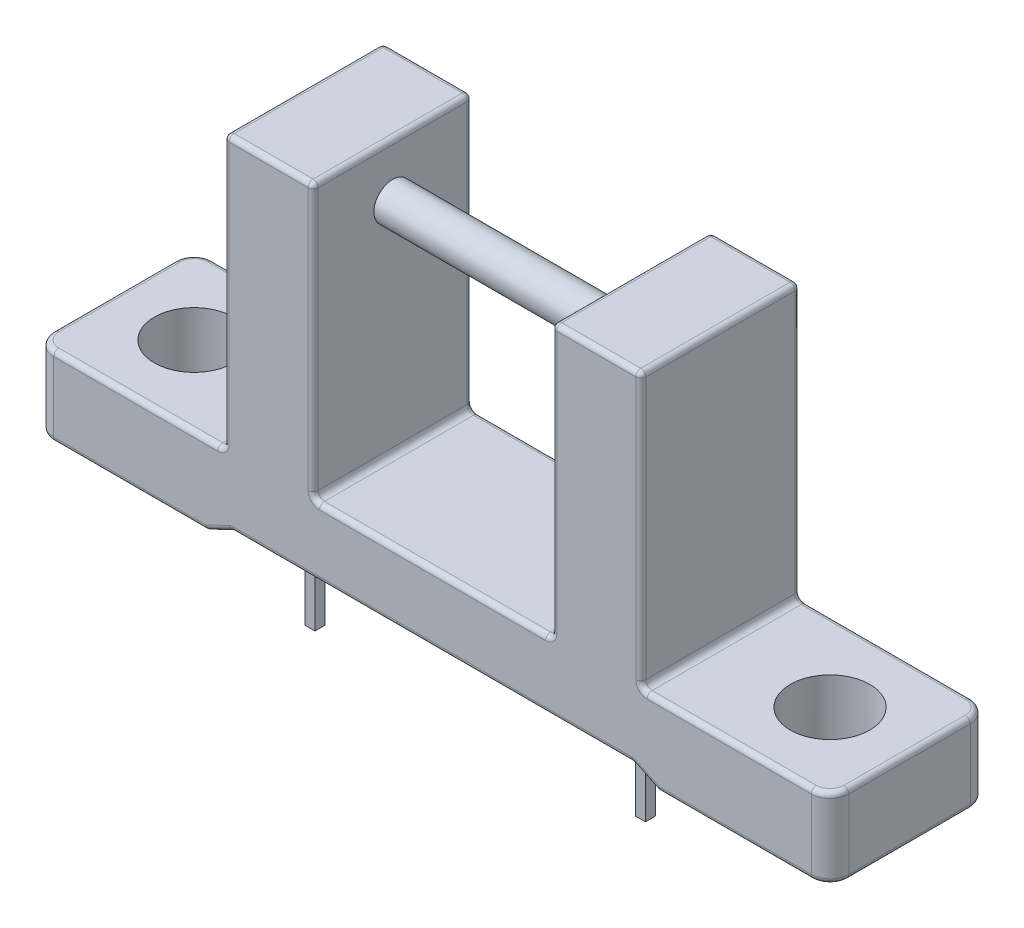
from build123d import *

# Parameters (mm, degrees)
SALIENTE_EXTRUIR1_DEPTH             = 3.175
REDONDEO1_R                         = 0.25
REDONDEO2_R                         = 0.75
REDONDEO3_R                         = 0.2
SALIENTE_EXTRUIR2_REACH             = 23.469
CROQUIS2_R                          = 0.75
SALIENTE_EXTRUIR2_DIRECTION_2_REACH = 23.469
CROQUIS3_W                          = 0.4
CROQUIS3_H                          = 0.4
SALIENTE_EXTRUIR3_DEPTH             = 3
SALIENTE_EXTRUIR3_DIRECTION_2_REACH = 23.469
CROQUIS4_R                          = 1.585
CORTAR_EXTRUIR1_DEPTH               = 20.527996667


with BuildPart() as part:
    # Croquis1 → Saliente-Extruir1 (new, symmetric)
    with BuildSketch(Plane.XY):
        Polygon((-8, 0.48), (8, 0.48), (9, 0), (15.875, 0), (15.875, 3.18), (8.32, 3.18), (8.32, 14.1), (4.765, 14.1), (4.765, 3.18), (-4.765, 3.18), (-4.765, 14.1), (-8.32, 14.1), (-8.32, 3.18), (-15.875, 3.18), (-15.875, 0), (-9, 0), align=None)
    extrude(amount=SALIENTE_EXTRUIR1_DEPTH, both=True)

    # Redondeo1
    redondeo1_edges = [part.edges().sort_by_distance(p)[0] for p in [
        (8.32, 3.18, 0),
        (-8.32, 3.18, 0),
        (-4.765, 3.18, 0),
        (4.765, 3.18, 0),
    ]]
    fillet(redondeo1_edges, radius=REDONDEO1_R)

    # Redondeo2
    redondeo2_edges = [part.edges().sort_by_distance(p)[0] for p in [
        (15.875, 1.59, -3.175),
        (-15.875, 1.59, -3.175),
        (-15.875, 1.59, 3.175),
        (15.875, 1.59, 3.175),
    ]]
    fillet(redondeo2_edges, radius=REDONDEO2_R)

    # Redondeo3
    redondeo3_edges = [part.edges().sort_by_distance(p)[0] for p in [
        (4.765, 8.765, 3.175),
        (12.0625, 0, -3.175),
        (8.5, 0.24, -3.175),
        (0, 0.48, -3.175),
        (-8.5, 0.24, -3.175),
        (-12.0625, 0, -3.175),
        (-6.5425, 14.1, -3.175),
        (-4.765, 8.765, -3.175),
        (-4.765, 8.765, 3.175),
        (4.765, 8.765, -3.175),
        (6.5425, 14.1, -3.175),
        (-6.5425, 14.1, 3.175),
        (9, 0, 0),
        (8, 0.48, 0),
        (-8, 0.48, 0),
        (-9, 0, 0),
        (-8.32, 14.1, 0),
        (-4.765, 14.1, 0),
        (4.765, 14.1, 0),
        (8.32, 14.1, 0),
        (-12.0625, 0, 3.175),
        (-8.5, 0.24, 3.175),
        (8.32, 8.765, -3.175),
        (8.32, 8.765, 3.175),
        (0, 3.18, -3.175),
        (0, 3.18, 3.175),
        (0, 0.48, 3.175),
        (8.5, 0.24, 3.175),
        (-8.32, 8.765, -3.175),
        (-8.32, 8.765, 3.175),
        (8.393223305, 3.253223305, -3.175),
        (8.393223305, 3.253223305, 3.175),
        (4.691776695, 3.253223305, -3.175),
        (4.691776695, 3.253223305, 3.175),
        (-4.691776695, 3.253223305, -3.175),
        (-4.691776695, 3.253223305, 3.175),
        (-8.393223305, 3.253223305, -3.175),
        (-8.393223305, 3.253223305, 3.175),
        (12.0625, 0, 3.175),
        (11.8475, 3.18, -3.175),
        (-11.8475, 3.18, -3.175),
        (-11.8475, 3.18, 3.175),
        (-15.875, 3.18, 0),
        (-15.655330086, 3.18, 2.955330086),
        (-15.655330086, 3.18, -2.955330086),
        (-15.875, 0, 0),
        (-15.655330086, 0, 2.955330086),
        (-15.655330086, 0, -2.955330086),
        (15.875, 3.18, 0),
        (15.875, 0, 0),
        (11.8475, 3.18, 3.175),
        (15.655330086, 3.18, 2.955330086),
        (15.655330086, 3.18, -2.955330086),
        (15.655330086, 0, 2.955330086),
        (15.655330086, 0, -2.955330086),
        (6.5425, 14.1, 3.175),
    ]]
    fillet(redondeo3_edges, radius=REDONDEO3_R)

    # Croquis2 → Saliente-Extruir2 (add, up to next)
    with BuildSketch(Plane(origin=(0, 0, 0), x_dir=(0, 0, -1), z_dir=(1, 0, 0)), mode=Mode.PRIVATE) as saliente_extruir2_sk1:
        with Locations(Location((0, 11.95, 0), (0, 0, 90))):
            Circle(CROQUIS2_R)
    saliente_extruir2_tool1 = extrude(saliente_extruir2_sk1.sketch, amount=SALIENTE_EXTRUIR2_REACH, mode=Mode.PRIVATE) - part.part
    add(saliente_extruir2_tool1.solids().sort_by_distance((0, 11.95, 0))[0])

    # Croquis2 → Saliente-Extruir2 direction 2 (add, up to next)
    with BuildSketch(Plane(origin=(0, 0, 0), x_dir=(0, 0, -1), z_dir=(1, 0, 0)), mode=Mode.PRIVATE) as saliente_extruir2_direction_2_sk1:
        with Locations(Location((0, 11.95, 0), (0, 0, 90))):
            Circle(CROQUIS2_R)
    saliente_extruir2_direction_2_tool1 = extrude(saliente_extruir2_direction_2_sk1.sketch, amount=-SALIENTE_EXTRUIR2_DIRECTION_2_REACH, mode=Mode.PRIVATE) - part.part
    add(saliente_extruir2_direction_2_tool1.solids().sort_by_distance((0, 11.95, 0))[0])

    # Croquis3 → Saliente-Extruir3 (add)
    with BuildSketch(Plane.XZ):
        with Locations((-6.6, 1.27)):
            Rectangle(CROQUIS3_W, CROQUIS3_H)
        with Locations((6.6, 1.27)):
            Rectangle(CROQUIS3_W, CROQUIS3_H)
        with Locations((6.6, -1.27)):
            Rectangle(CROQUIS3_W, CROQUIS3_H)
        with Locations((-6.6, -1.27)):
            Rectangle(CROQUIS3_W, CROQUIS3_H)
    extrude(amount=SALIENTE_EXTRUIR3_DEPTH)

    # Croquis3 → Saliente-Extruir3 direction 2 (add, up to next)
    with BuildSketch(Plane.XZ, mode=Mode.PRIVATE) as saliente_extruir3_direction_2_sk1:
        with Locations((-6.6, 1.27)):
            Rectangle(CROQUIS3_W, CROQUIS3_H)
    saliente_extruir3_direction_2_tool1 = extrude(saliente_extruir3_direction_2_sk1.sketch, amount=-SALIENTE_EXTRUIR3_DIRECTION_2_REACH, mode=Mode.PRIVATE) - part.part
    # Croquis3 → Saliente-Extruir3 direction 2 (add, up to next)
    with BuildSketch(Plane.XZ, mode=Mode.PRIVATE) as saliente_extruir3_direction_2_sk2:
        with Locations((6.6, 1.27)):
            Rectangle(CROQUIS3_W, CROQUIS3_H)
    saliente_extruir3_direction_2_tool2 = extrude(saliente_extruir3_direction_2_sk2.sketch, amount=-SALIENTE_EXTRUIR3_DIRECTION_2_REACH, mode=Mode.PRIVATE) - part.part
    # Croquis3 → Saliente-Extruir3 direction 2 (add, up to next)
    with BuildSketch(Plane.XZ, mode=Mode.PRIVATE) as saliente_extruir3_direction_2_sk3:
        with Locations((6.6, -1.27)):
            Rectangle(CROQUIS3_W, CROQUIS3_H)
    saliente_extruir3_direction_2_tool3 = extrude(saliente_extruir3_direction_2_sk3.sketch, amount=-SALIENTE_EXTRUIR3_DIRECTION_2_REACH, mode=Mode.PRIVATE) - part.part
    # Croquis3 → Saliente-Extruir3 direction 2 (add, up to next)
    with BuildSketch(Plane.XZ, mode=Mode.PRIVATE) as saliente_extruir3_direction_2_sk4:
        with Locations((-6.6, -1.27)):
            Rectangle(CROQUIS3_W, CROQUIS3_H)
    saliente_extruir3_direction_2_tool4 = extrude(saliente_extruir3_direction_2_sk4.sketch, amount=-SALIENTE_EXTRUIR3_DIRECTION_2_REACH, mode=Mode.PRIVATE) - part.part
    add(saliente_extruir3_direction_2_tool1.solids().sort_by_distance((-6.6, 0, 1.27))[0])
    add(saliente_extruir3_direction_2_tool2.solids().sort_by_distance((6.6, 0, 1.27))[0])
    add(saliente_extruir3_direction_2_tool3.solids().sort_by_distance((6.6, 0, -1.27))[0])
    add(saliente_extruir3_direction_2_tool4.solids().sort_by_distance((-6.6, 0, -1.27))[0])

    # Croquis4 → Cortar-Extruir1 (cut, through all)
    with BuildSketch(Plane(origin=(0, 3.18, 0), x_dir=(1, 0, 0), z_dir=(0, 1, 0))):
        with Locations(Location((-12.7, 0, 0), (0, 0, 180))):
            Circle(CROQUIS4_R)
        with Locations(Location((12.7, 0, 0), (0, 0, 270))):
            Circle(CROQUIS4_R)
    extrude(amount=-CORTAR_EXTRUIR1_DEPTH, mode=Mode.SUBTRACT)


solid = part.part
